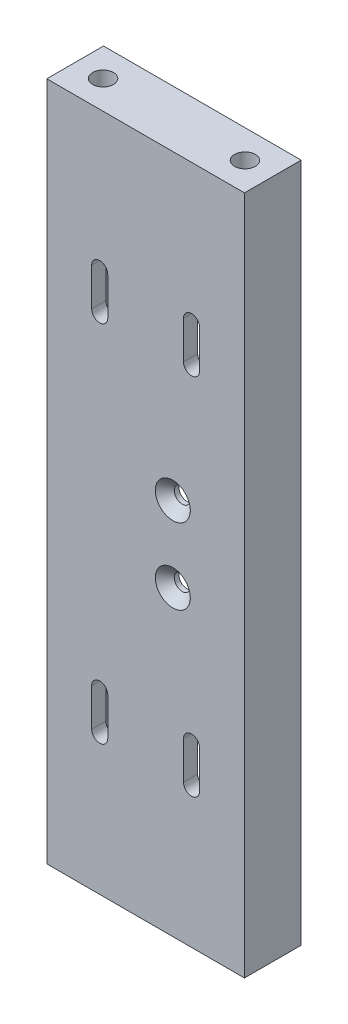
from build123d import *

# Parameters (mm, degrees)
SKETCH1_W                 = 41.8
SKETCH1_H                 = 143.8
BOSS_EXTRUDE1_DEPTH       = 12
SHELL1_T                  = -7
SHELL1_THICKNESS_2_FACE_W = 27.8
SHELL1_THICKNESS_2_FACE_H = 129.8
SHELL1_THICKNESS_2_DEPTH  = 4
SKETCH2_R                 = 2.2
CUT_EXTRUDE1_DEPTH        = 5.2
SKETCH3_R                 = 2.2
CUT_EXTRUDE2_DEPTH        = 5.2
SKETCH5_R                 = 1.7
CUT_EXTRUDE3_DEPTH        = 10
CHAMFER1_SIZE             = 2
CUT_EXTRUDE4_DEPTH        = 3.5


with BuildPart() as part:
    # Sketch1 → Boss-Extrude1 (new body)
    with BuildSketch(Plane.XY):
        with Locations((0, 71.9)):
            Rectangle(SKETCH1_W, SKETCH1_H)
    extrude(amount=-BOSS_EXTRUDE1_DEPTH)

    # Shell1
    shell1_openings = [part.faces().sort_by_distance(p)[0] for p in [
        (0, 71.9, -12),
    ]]
    offset(amount=SHELL1_T, openings=shell1_openings, kind=Kind.INTERSECTION)

    # Shell1 thickness 2 face (on inner face of the shell) → Shell1 thickness 2 (cut)
    with BuildSketch(Plane(origin=(0, 71.9, -7), x_dir=(1, 0, 0), z_dir=(0, 0, 1))):
        Rectangle(SHELL1_THICKNESS_2_FACE_W, SHELL1_THICKNESS_2_FACE_H)
    extrude(amount=SHELL1_THICKNESS_2_DEPTH, mode=Mode.SUBTRACT)

    # Sketch2 → Cut-Extrude1 (cut)
    with BuildSketch(Plane(origin=(0, 143.8, 0), x_dir=(1, 0, 0), z_dir=(0, 1, 0))):
        with Locations(Location((-15, 6, 0), (0, 0, 270))):
            Circle(SKETCH2_R)
        with Locations(Location((15, 6, 0), (0, 0, 270))):
            Circle(SKETCH2_R)
    cut_extrude1 = extrude(amount=-CUT_EXTRUDE1_DEPTH, mode=Mode.SUBTRACT)

    # Mirror1: Cut-Extrude1 across plane
    add(cut_extrude1.mirror(Plane.ZX.offset(71.9)), mode=Mode.SUBTRACT)

    # Sketch3 → Cut-Extrude2 (cut)
    with BuildSketch(Plane.ZY.offset(20.9)):
        with Locations((-6, 129.4)):
            Circle(SKETCH3_R)
        with Locations((-6, 14.4)):
            Circle(SKETCH3_R)
    extrude(amount=-CUT_EXTRUDE2_DEPTH, mode=Mode.SUBTRACT)

    # Sketch5 → Cut-Extrude3 (cut)
    with BuildSketch(Plane(origin=(0, 0, -3), x_dir=(-1, 0, 0), z_dir=(0, 0, -1))):
        with Locations((-5.75, 63.9)):
            Circle(SKETCH5_R)
        with Locations((-5.75, 79.9)):
            Circle(SKETCH5_R)
    extrude(amount=-CUT_EXTRUDE3_DEPTH, mode=Mode.SUBTRACT)

    # Chamfer1
    chamfer1_edges = [part.edges().sort_by_distance(p)[0] for p in [
        (7.45, 63.9, 0),
        (7.45, 79.9, 0),
    ]]
    chamfer(chamfer1_edges, length=CHAMFER1_SIZE)

    # Sketch6 → Cut-Extrude4 (cut)
    with BuildSketch(Plane(origin=(0, 0, -3), x_dir=(-1, 0, 0), z_dir=(0, 0, -1))):
        with BuildLine():
            Line((11.409552025, 37.4), (11.409552025, 29.4))
            ThreePointArc((11.409552025, 29.4), (9.709552025, 27.7), (8.009552025, 29.4))
            Line((8.009552025, 29.4), (8.009552025, 37.4))
            ThreePointArc((8.009552025, 37.4), (9.709552025, 39.1), (11.409552025, 37.4))
        make_face()
        with BuildLine():
            Line((11.409552025, 106.4), (11.409552025, 114.4))
            ThreePointArc((11.409552025, 114.4), (9.709552025, 116.1), (8.009552025, 114.4))
            Line((8.009552025, 114.4), (8.009552025, 106.4))
            ThreePointArc((8.009552025, 106.4), (9.709552025, 104.7), (11.409552025, 106.4))
        make_face()
        with BuildLine():
            Line((-11.409552025, 106.4), (-11.409552025, 114.4))
            ThreePointArc((-11.409552025, 114.4), (-9.709552025, 116.1), (-8.009552025, 114.4))
            Line((-8.009552025, 114.4), (-8.009552025, 106.4))
            ThreePointArc((-8.009552025, 106.4), (-9.709552025, 104.7), (-11.409552025, 106.4))
        make_face()
        with BuildLine():
            Line((-11.409552025, 37.4), (-11.409552025, 29.4))
            ThreePointArc((-11.409552025, 29.4), (-9.709552025, 27.7), (-8.009552025, 29.4))
            Line((-8.009552025, 29.4), (-8.009552025, 37.4))
            ThreePointArc((-8.009552025, 37.4), (-9.709552025, 39.1), (-11.409552025, 37.4))
        make_face()
    extrude(amount=-CUT_EXTRUDE4_DEPTH, mode=Mode.SUBTRACT)


solid = part.part
